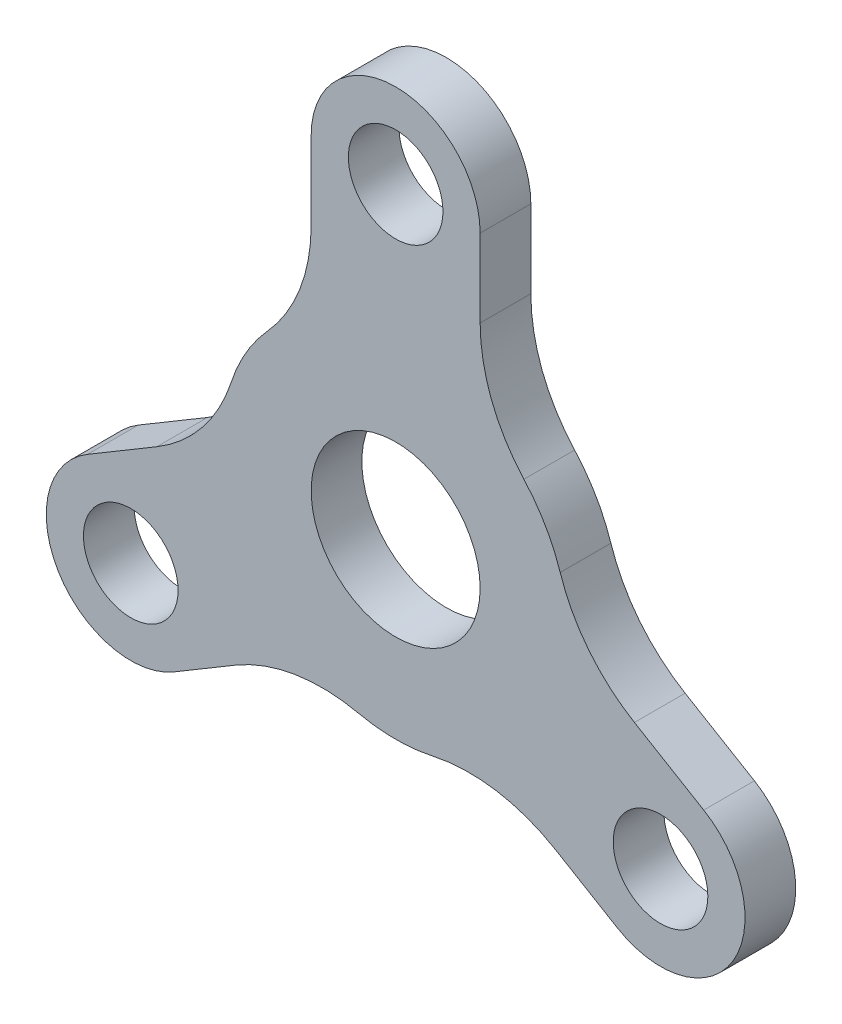
from build123d import *

# Parameters (mm, degrees)
SALIENTE_EXTRUIR1_DEPTH = 3
CROQUIS2_R              = 2.8
CORTAR_EXTRUIR1_DEPTH   = 10
CROQUIS3_R              = 5
CORTAR_EXTRUIR2_DEPTH   = 10
REDONDEO1_R             = 10


with BuildPart() as part:
    # Croquis1 → Saliente-Extruir1 (new body)
    with BuildSketch(Plane.XY):
        with BuildLine():
            Line((-13.118348224, -13.346885602), (-5.358962429, -8.729934305))
            ThreePointArc((-5.358962429, -8.729934305), (0, -10.243545836), (5.358962429, -8.729934305))
            Line((5.358962429, -8.729934305), (13.118348224, -13.346885602))
            ThreePointArc((13.118348224, -13.346885602), (19.97194541, -11.606711584), (18.231771393, -4.753114398))
            Line((18.231771393, -4.753114398), (10.243545836, 0))
            ThreePointArc((10.243545836, 0), (8.83594818, 5.182301714), (5, 8.94037087))
            Line((5, 8.94037087), (5, 18.2))
            ThreePointArc((5, 18.2), (0, 23.2), (-5, 18.2))
            Line((-5, 18.2), (-5, 8.94037087))
            ThreePointArc((-5, 8.94037087), (-8.83594818, 5.182301714), (-10.243545836, 0))
            Line((-10.243545836, 0), (-18.231771393, -4.753114398))
            ThreePointArc((-18.231771393, -4.753114398), (-19.97194541, -11.606711584), (-13.118348224, -13.346885602))
        make_face()
    extrude(amount=SALIENTE_EXTRUIR1_DEPTH)

    # Croquis2 → Cortar-Extruir1 (cut)
    with BuildSketch(Plane.XY.offset(3)):
        with Locations((0, 18.2)):
            Circle(CROQUIS2_R)
        with Locations((15.675059808, -9.05)):
            Circle(CROQUIS2_R)
        with Locations((-15.675059808, -9.05)):
            Circle(CROQUIS2_R)
    extrude(amount=-CORTAR_EXTRUIR1_DEPTH, mode=Mode.SUBTRACT)

    # Croquis3 → Cortar-Extruir2 (cut)
    with BuildSketch(Plane.XY.offset(3)):
        Circle(CROQUIS3_R)
    extrude(amount=-CORTAR_EXTRUIR2_DEPTH, mode=Mode.SUBTRACT)

    # Redondeo1
    redondeo1_edges = [part.edges().sort_by_distance(p)[0] for p in [
        (-10.243545836, 0, 1.5),
        (-5, 8.94037087, 1.5),
        (5, 8.94037087, 1.5),
        (10.243545836, 0, 1.5),
        (5.358962429, -8.729934305, 1.5),
        (-5.358962429, -8.729934305, 1.5),
    ]]
    fillet(redondeo1_edges, radius=REDONDEO1_R)


solid = part.part
